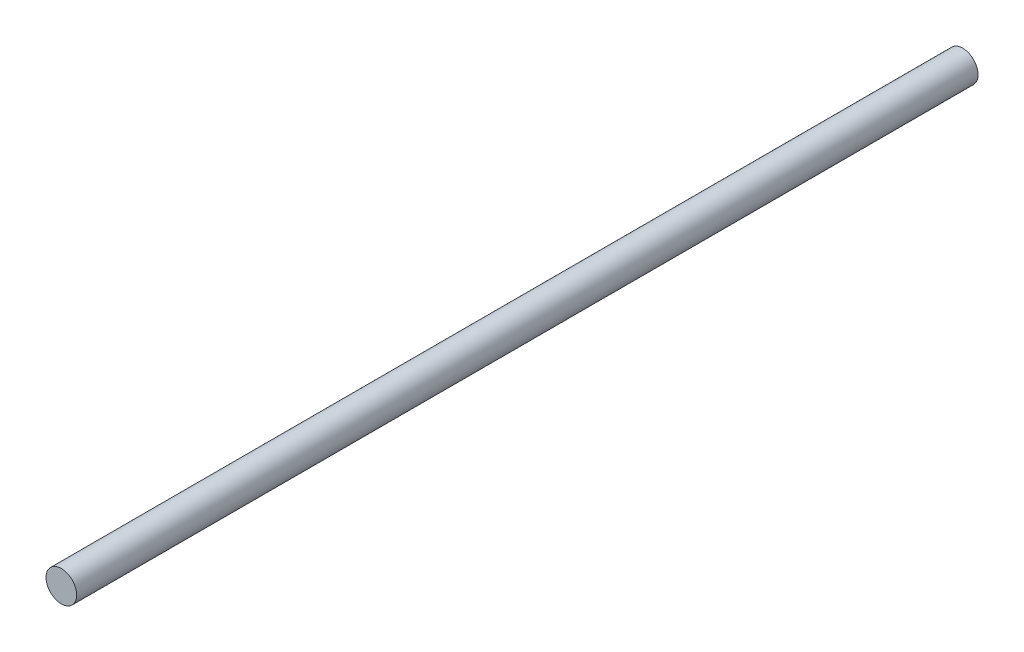
from build123d import *

# Parameters (mm, degrees)
SKETCH1_R           = 4
BOSS_EXTRUDE1_DEPTH = 235


with BuildPart() as part:
    # Sketch1 → Boss-Extrude1 (new body)
    with BuildSketch(Plane.XY):
        with Locations(Location((0, 0, 0), (0, 0, 180))):
            Circle(SKETCH1_R)
    extrude(amount=BOSS_EXTRUDE1_DEPTH)


solid = part.part
